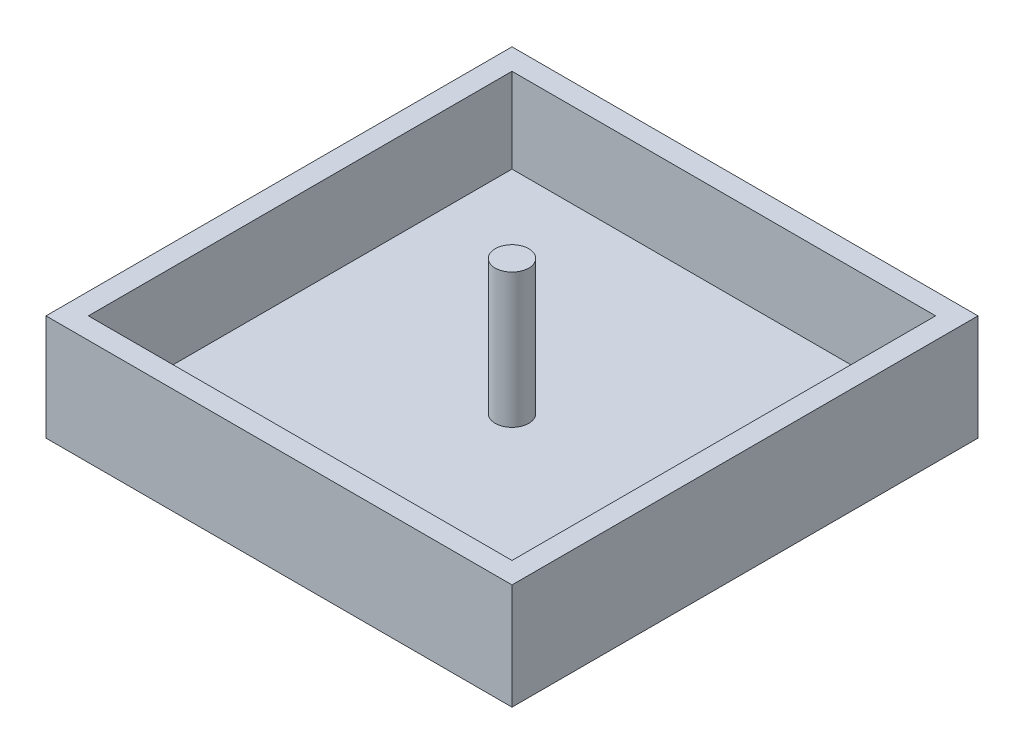
from build123d import *

# Parameters (mm, degrees)
ESBO_O1_W                = 40
ESBO_O1_H                = 40
RESSALTO_EXTRUS_O1_DEPTH = 2
ESBO_O2_W                = 40
ESBO_O2_H                = 40
RESSALTO_EXTRUS_O2_DEPTH = 10
ESBO_O3_R                = 1.585
RESSALTO_EXTRUS_O3_DEPTH = 12.7


with BuildPart() as part:
    # Esboço1 → Ressalto-extrusão1 (new body)
    with BuildSketch(Plane(origin=(0, 0, 0), x_dir=(1, 0, 0), z_dir=(0, 1, 0))):
        with Locations((-15.012062533, -15.012062533)):
            Rectangle(ESBO_O1_W, ESBO_O1_H)
    extrude(amount=RESSALTO_EXTRUS_O1_DEPTH)

    # Esboço2 → Ressalto-extrusão2 (add)
    with BuildSketch(Plane.XZ):
        Polygon((-37.012062533, 37.012062533), (-37.012062533, 35.012062533), (-37.012062533, -6.987937467), (-35.012062533, -6.987937467), (6.987937467, -6.987937467), (6.987937467, -4.987937467), (6.987937467, 37.012062533), (4.987937467, 37.012062533), align=None)
        with Locations((-15.012062533, 15.012062533)):
            Rectangle(ESBO_O2_W, ESBO_O2_H, mode=Mode.SUBTRACT)
    extrude(amount=-RESSALTO_EXTRUS_O2_DEPTH)

    # Esboço3 → Ressalto-extrusão3 (add)
    with BuildSketch(Plane(origin=(0, 2, 0), x_dir=(1, 0, 0), z_dir=(0, 1, 0))):
        with Locations(Location((-15.012062533, -15.012062533, 0), (0, 0, 270))):
            Circle(ESBO_O3_R)
    extrude(amount=RESSALTO_EXTRUS_O3_DEPTH)


solid = part.part
